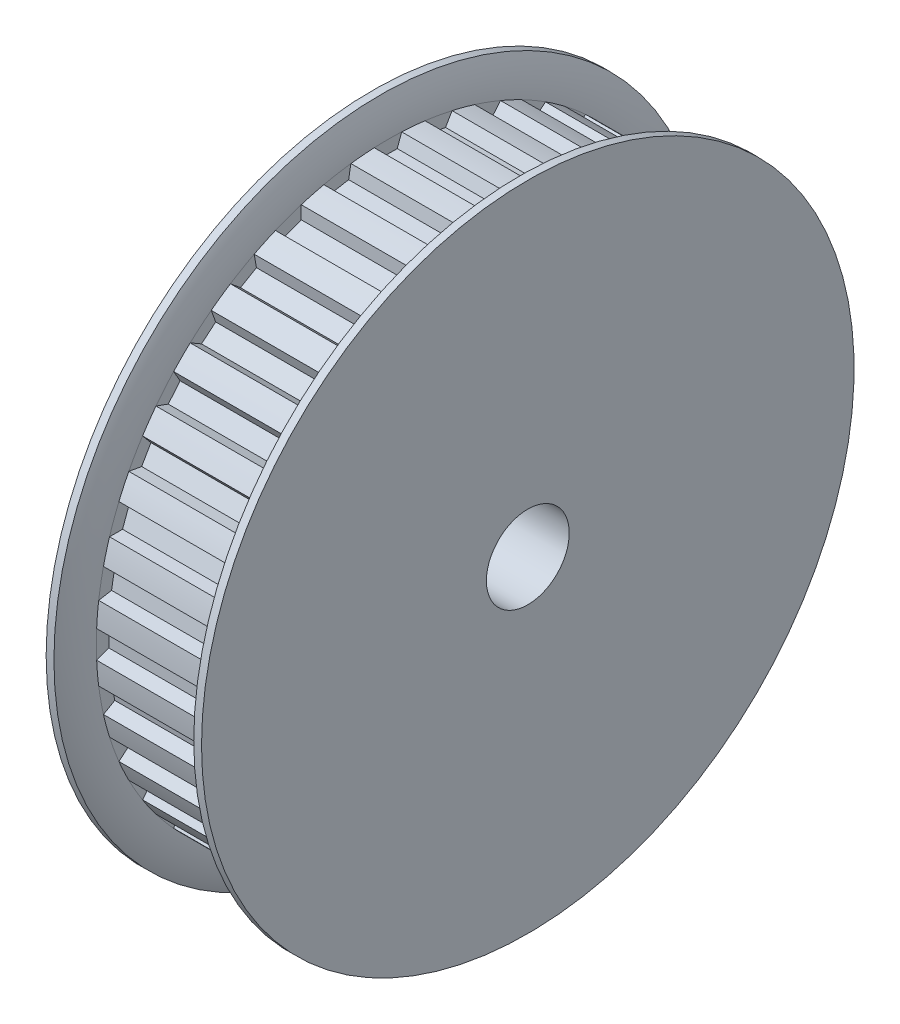
from build123d import *

# Parameters (mm, degrees)
CUT_EXTRUDE1_START = 9
CUT_EXTRUDE1_DEPTH = 12
CIRPATTERN1_COUNT  = 36


with BuildPart() as part:
    # Sketch6 → Revolve1 (revolve)
    with BuildSketch(Plane.XY, mode=Mode.PRIVATE) as revolve1_sk:
        with BuildLine():
            Line((9.75, 31.5), (10.5, 31.5))
            Line((10.5, 31.5), (10.5, 4))
            Line((10.5, 4), (-10.5, 4))
            Line((-10.5, 4), (-10.5, 19))
            Line((-10.5, 19), (-4.5, 19))
            Line((-4.5, 19), (-4.5, 31.5))
            Line((-4.5, 31.5), (-3.75, 31.5))
            ThreePointArc((-3.75, 31.5), (-3.189799086, 29.869024869), (-3, 28.155))
            Line((-3, 28.155), (9, 28.155))
            ThreePointArc((9, 28.155), (9.189799086, 29.869024869), (9.75, 31.5))
        make_face()
    revolve(revolve1_sk.sketch.rotate(Axis((-10.5, 0, 0), (1, 0, 0)), 90), axis=Axis((-10.5, 0, 0), (1, 0, 0)))

    # Sketch3 → Cut-Extrude1 (cut)
    with BuildSketch(Plane(origin=(0, 0, 0), x_dir=(0, 0, -1), z_dir=(1, 0, 0)).offset(CUT_EXTRUDE1_START)):
        with BuildLine():
            Line((-1.325, 28.123804863), (-0.894190044, 26.940164238))
            Line((-0.894190044, 26.940164238), (0.894190044, 26.940164238))
            Line((0.894190044, 26.940164238), (1.325, 28.123804863))
            ThreePointArc((1.325, 28.123804863), (0, 28.155), (-1.325, 28.123804863))
        make_face()
    cut_extrude1 = extrude(amount=-CUT_EXTRUDE1_DEPTH, mode=Mode.SUBTRACT)

    # CirPattern1: Cut-Extrude1 ×36 about axis
    cirpattern1_axis = Axis((0, 0, 0), (1, 0, 0))
    for i in range(1, CIRPATTERN1_COUNT):
        add(cut_extrude1.rotate(cirpattern1_axis, i * 360 / CIRPATTERN1_COUNT), mode=Mode.SUBTRACT)


solid = part.part
